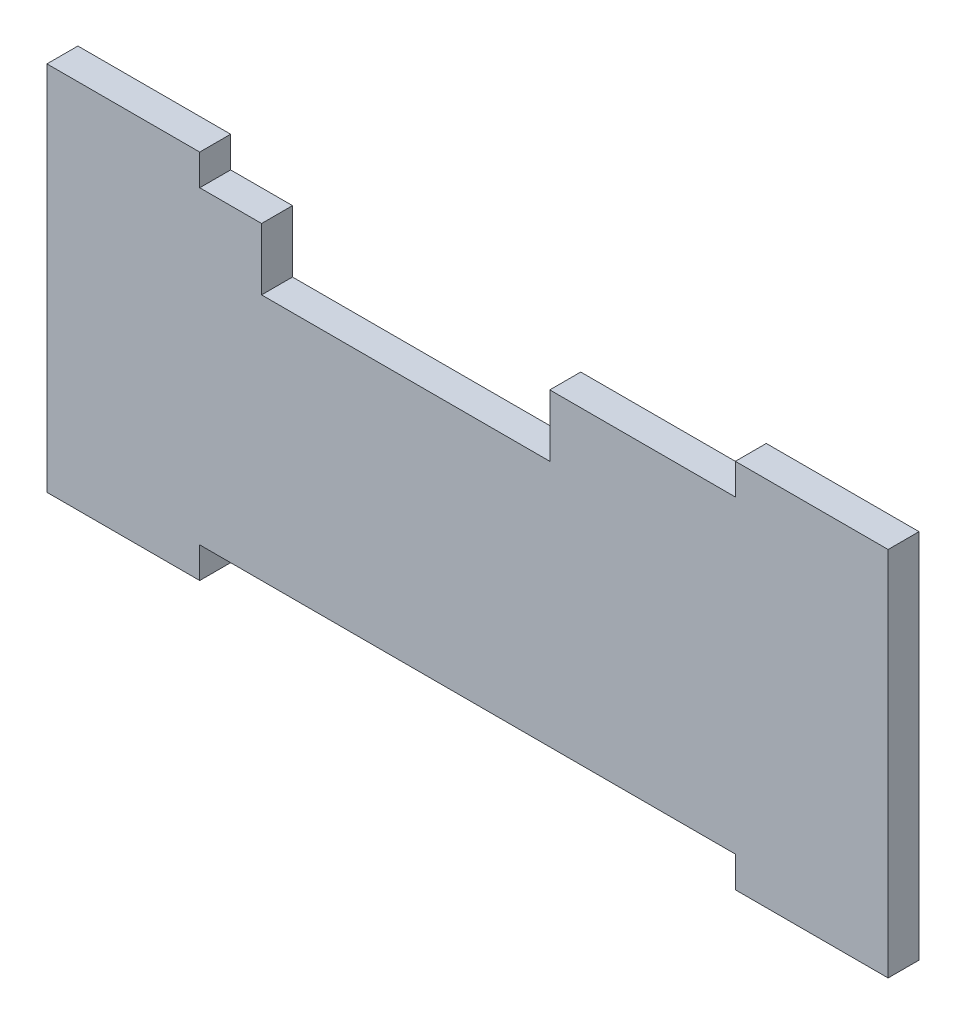
from build123d import *

# Parameters (mm, degrees)
SKETCH1_W           = 136
SKETCH1_H           = 50
BOSS_EXTRUDE1_DEPTH = 5
SKETCH2_W           = 24.7
SKETCH2_H           = 5
BOSS_EXTRUDE2_DEPTH = 5
SKETCH3_W           = 24.7
SKETCH3_H           = 5
BOSS_EXTRUDE3_DEPTH = 5
SKETCH4_W           = 46.6
SKETCH4_H           = 10
CUT_EXTRUDE1_DEPTH  = 5


with BuildPart() as part:
    # Sketch1 → Boss-Extrude1 (new body)
    with BuildSketch(Plane.XY):
        with Locations((0, 25)):
            Rectangle(SKETCH1_W, SKETCH1_H)
    extrude(amount=BOSS_EXTRUDE1_DEPTH)

    # Sketch2 → Boss-Extrude2 (add)
    with BuildSketch(Plane(origin=(0, 50, 0), x_dir=(1, 0, 0), z_dir=(0, 1, 0))):
        with Locations((-55.65, -2.5)):
            Rectangle(SKETCH2_W, SKETCH2_H)
        with Locations((55.65, -2.5)):
            Rectangle(SKETCH2_W, SKETCH2_H)
    extrude(amount=BOSS_EXTRUDE2_DEPTH)

    # Sketch3 → Boss-Extrude3 (add)
    with BuildSketch(Plane.XZ):
        with Locations((-55.65, 2.5)):
            Rectangle(SKETCH3_W, SKETCH3_H)
        with Locations((55.65, 2.5)):
            Rectangle(SKETCH3_W, SKETCH3_H)
    extrude(amount=BOSS_EXTRUDE3_DEPTH)

    # Sketch4 → Cut-Extrude1 (cut)
    with BuildSketch(Plane.XY.offset(5)):
        with Locations((-10, 45)):
            Rectangle(SKETCH4_W, SKETCH4_H)
    extrude(amount=-CUT_EXTRUDE1_DEPTH, mode=Mode.SUBTRACT)


solid = part.part
